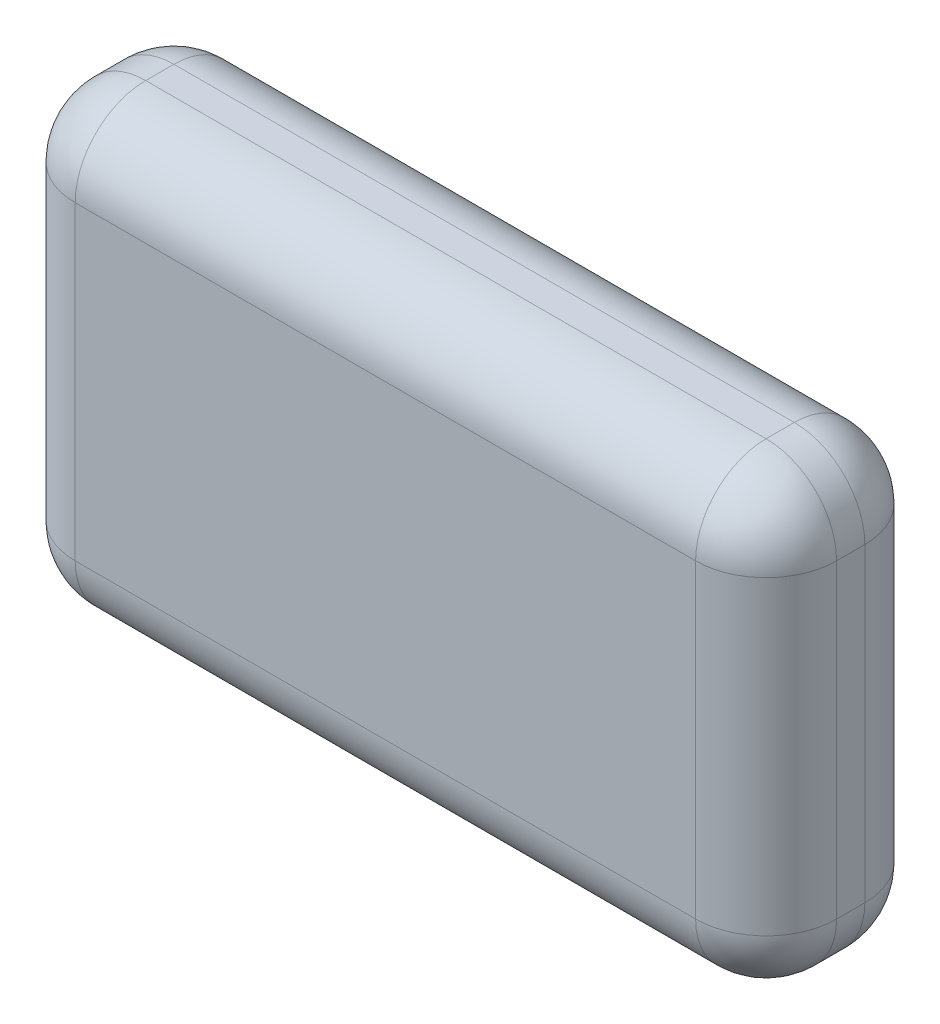
from build123d import *

# Parameters (mm, degrees)
CROQUIS1_W              = 108
CROQUIS1_H              = 64
SALIENTE_EXTRUIR1_DEPTH = 24
REDONDEO1_R             = 10


with BuildPart() as part:
    # Croquis1 → Saliente-Extruir1 (new body)
    with BuildSketch(Plane.XY):
        Rectangle(CROQUIS1_W, CROQUIS1_H)
    extrude(amount=SALIENTE_EXTRUIR1_DEPTH)

    # Redondeo1
    redondeo1_edges = [part.edges().sort_by_distance(p)[0] for p in [
        (-54, 0, 24),
        (0, -32, 24),
        (54, 0, 24),
        (0, -32, 0),
        (-54, 0, 0),
        (0, 32, 0),
        (54, 0, 0),
        (54, -32, 12),
        (-54, -32, 12),
        (-54, 32, 12),
        (54, 32, 12),
        (0, 32, 24),
    ]]
    fillet(redondeo1_edges, radius=REDONDEO1_R)


solid = part.part
